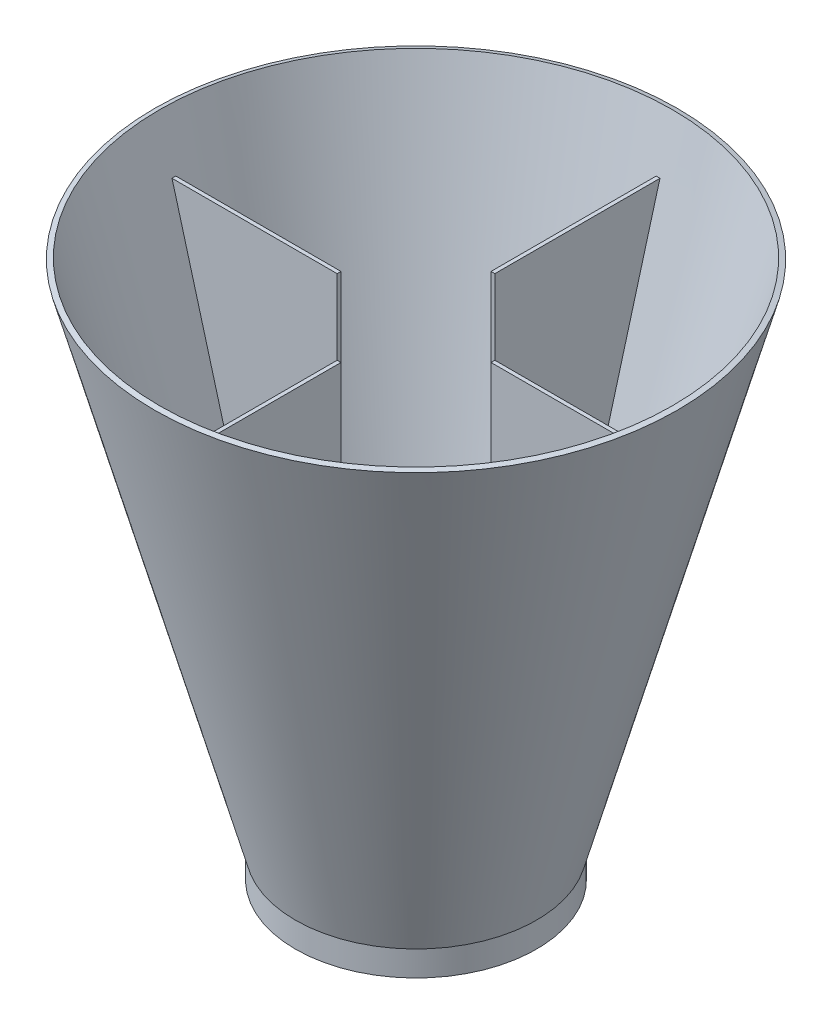
from build123d import *

# Parameters (mm, degrees)
SKETCH2_R                = 47.017523695
SKETCH2_R_2              = 13.35
BOSS_EXTRUDE1_DEPTH      = 10
BOSS_EXTRUDE2_DEPTH      = 0.75
BOSS_EXTRUDE2_DEPTH_BACK = 0.75
CIRPATTERN3_COUNT        = 4


with BuildPart() as part:
    # Sketch1 → Revolve-Thin1 (revolve)
    with BuildSketch(Plane(origin=(0, 0, 0), x_dir=(0, 0, -1), z_dir=(1, 0, 0))):
        Polygon((100, 200), (45, 0), (46.928410786, -0.530312966), (101.928410786, 199.469687034), align=None)
    revolve(axis=Axis((0, 0, 0), (0, 1, 0)))

    # Sketch2 → Boss-Extrude1 (add)
    with BuildSketch(Plane(origin=(0, 0, 0), x_dir=(1, 0, 0), z_dir=(0, 1, 0))):
        Circle(SKETCH2_R)
        Circle(SKETCH2_R_2, mode=Mode.SUBTRACT)
    extrude(amount=-BOSS_EXTRUDE1_DEPTH)


with BuildPart() as body_2:
    # Sketch3 → Boss-Extrude2 (new, two sides: drawn at the far end of the back side and taken through both)
    with BuildSketch(Plane(origin=(0, 0, 0), x_dir=(0, 0, -1), z_dir=(1, 0, 0)).offset(-BOSS_EXTRUDE2_DEPTH_BACK)):
        Polygon((30, 180), (30, 30), (53.25, 30), (94.5, 180), align=None)
    extrude(amount=BOSS_EXTRUDE2_DEPTH + BOSS_EXTRUDE2_DEPTH_BACK)


with BuildPart() as cirpattern3_1:
    # CirPattern3: pattern copy
    add(body_2.part.rotate(Axis((0, 200, 0), (0, -1, 0)), 1 * 360 / CIRPATTERN3_COUNT))


with BuildPart() as cirpattern3_2:
    # CirPattern3: pattern copy
    add(body_2.part.rotate(Axis((0, 200, 0), (0, -1, 0)), 2 * 360 / CIRPATTERN3_COUNT))


with BuildPart() as cirpattern3_3:
    # CirPattern3: pattern copy
    add(body_2.part.rotate(Axis((0, 200, 0), (0, -1, 0)), 3 * 360 / CIRPATTERN3_COUNT))


solid = Compound([part.part, body_2.part, cirpattern3_1.part, cirpattern3_2.part, cirpattern3_3.part])
